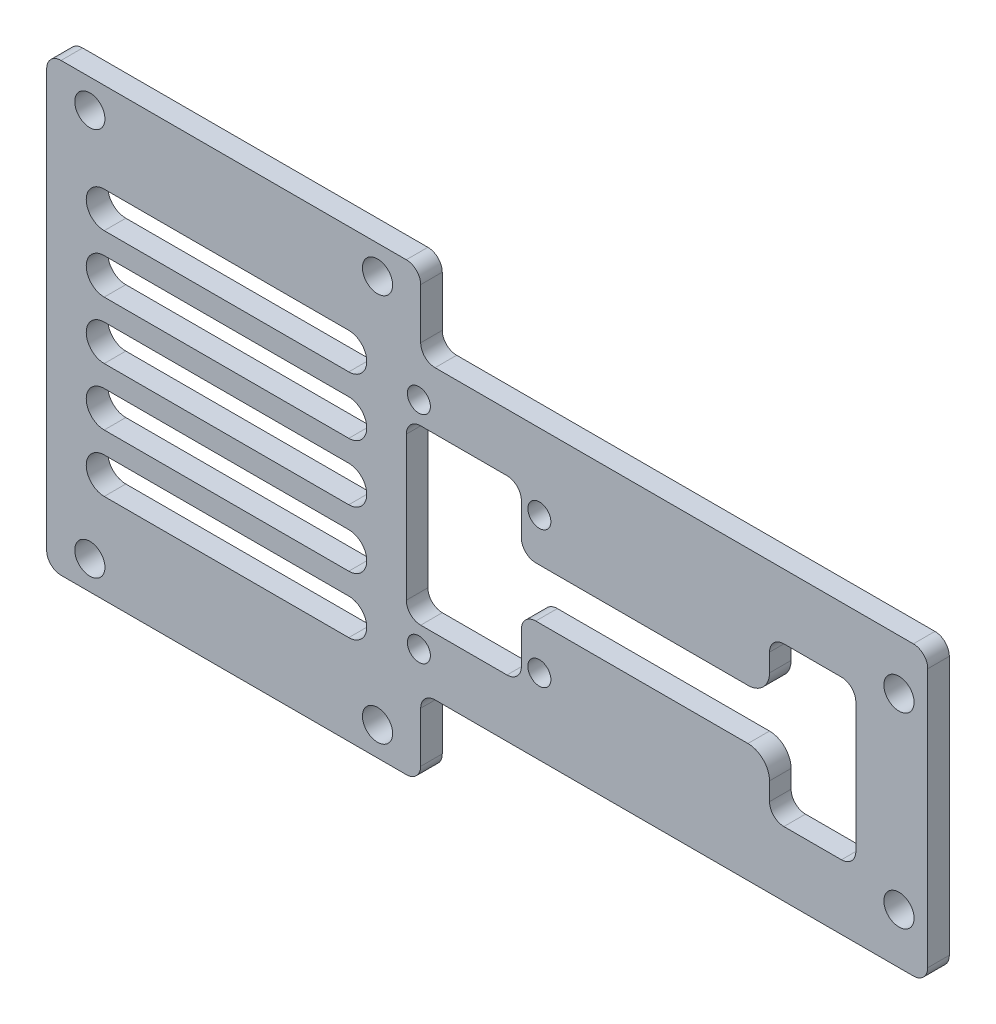
from build123d import *

# Parameters (mm, degrees)
SKETCH_1_R          = 2.1
SKETCH_1_R_2        = 1.599999998
SKETCH_1_R_3        = 2.099999998
SKETCH_1_R_4        = 1.6
EXTRUDE_1_DEPTH     = 3
FILLET_1_R          = 2
CUT_EXTRUDE_1_DEPTH = 115.739923305
SKETCH_3_W          = 8.5
SKETCH_3_H          = 7
CUT_EXTRUDE_2_DEPTH = 115.739923305
FILLET_2_R          = 3


with BuildPart() as part:
    # 草图1 → 凸台-拉伸1 (new body)
    with BuildSketch(Plane.XY):
        Polygon((-26, 0), (-26, -62), (26, -62), (26, -51), (96.5, -51), (96.5, -11), (26, -11), (26, 0), align=None)
        with Locations((-20, -4)):
            Circle(SKETCH_1_R, mode=Mode.SUBTRACT)
        with Locations((20, -4)):
            Circle(SKETCH_1_R, mode=Mode.SUBTRACT)
        with Locations((-20, -58)):
            Circle(SKETCH_1_R, mode=Mode.SUBTRACT)
        with Locations((20, -58)):
            Circle(SKETCH_1_R, mode=Mode.SUBTRACT)
        with Locations((42.500000002, -21.5)):
            Circle(SKETCH_1_R_2, mode=Mode.SUBTRACT)
        with Locations((42.500000002, -40.5)):
            Circle(SKETCH_1_R_2, mode=Mode.SUBTRACT)
        with Locations((92.500000002, -18)):
            Circle(SKETCH_1_R_3, mode=Mode.SUBTRACT)
        with Locations((92.500000002, -44)):
            Circle(SKETCH_1_R_3, mode=Mode.SUBTRACT)
        with Locations((25.75, -46)):
            Circle(SKETCH_1_R_4, mode=Mode.SUBTRACT)
        with Locations((25.75, -16)):
            Circle(SKETCH_1_R_4, mode=Mode.SUBTRACT)
        Polygon((68, -34.5), (68, -27.5), (40, -27.5), (40, -19), (24, -19), (24, -43), (40, -43), (40, -34.5), align=None, mode=Mode.SUBTRACT)
    extrude(amount=EXTRUDE_1_DEPTH)

    # 圆角1
    fillet_1_edges = [part.edges().sort_by_distance(p)[0] for p in [
        (26, 0, 1.5),
        (26, -11, 1.5),
        (96.5, -11, 1.5),
        (96.5, -51, 1.5),
        (26, -51, 1.5),
        (26, -62, 1.5),
        (-26, -62, 1.5),
        (-26, 0, 1.5),
        (40, -43, 1.5),
        (40, -34.5, 1.5),
        (68, -34.5, 1.5),
        (68, -27.5, 1.5),
        (40, -27.5, 1.5),
        (40, -19, 1.5),
        (24, -19, 1.5),
        (24, -43, 1.5),
    ]]
    fillet(fillet_1_edges, radius=FILLET_1_R)

    # 草图2 → 切除-拉伸1 (cut, through all)
    with BuildSketch(Plane.XY.offset(3)):
        with BuildLine():
            Line((-18, -28.5), (16, -28.5))
            ThreePointArc((16, -28.5), (18.5, -31), (16, -33.5))
            Line((16, -33.5), (-18, -33.5))
            ThreePointArc((-18, -33.5), (-20.5, -31), (-18, -28.5))
        make_face()
        with BuildLine():
            Line((-18, -20.5), (16, -20.5))
            ThreePointArc((16, -20.5), (18.5, -23), (16, -25.5))
            Line((16, -25.5), (-18, -25.5))
            ThreePointArc((-18, -25.5), (-20.5, -23), (-18, -20.5))
        make_face()
        with BuildLine():
            Line((-18, -12.5), (16, -12.5))
            ThreePointArc((16, -12.5), (18.5, -15), (16, -17.5))
            Line((16, -17.5), (-18, -17.5))
            ThreePointArc((-18, -17.5), (-20.5, -15), (-18, -12.5))
        make_face()
        with BuildLine():
            Line((-18, -36.5), (16, -36.5))
            ThreePointArc((16, -36.5), (18.5, -39), (16, -41.5))
            Line((16, -41.5), (-18, -41.5))
            ThreePointArc((-18, -41.5), (-20.5, -39), (-18, -36.5))
        make_face()
        with BuildLine():
            Line((-18, -44.5), (16, -44.5))
            ThreePointArc((16, -44.5), (18.5, -47), (16, -49.5))
            Line((16, -49.5), (-18, -49.5))
            ThreePointArc((-18, -49.5), (-20.5, -47), (-18, -44.5))
        make_face()
        with BuildLine():
            Line((74.5, -22), (74.5, -40))
            ThreePointArc((74.5, -40), (75.085786438, -41.414213562), (76.5, -42))
            Line((76.5, -42), (84.5, -42))
            ThreePointArc((84.5, -42), (85.914213562, -41.414213562), (86.5, -40))
            Line((86.5, -40), (86.5, -22))
            ThreePointArc((86.5, -22), (85.914213562, -20.585786438), (84.5, -20))
            Line((84.5, -20), (76.5, -20))
            ThreePointArc((76.5, -20), (75.085786438, -20.585786438), (74.5, -22))
        make_face()
    extrude(amount=-CUT_EXTRUDE_1_DEPTH, mode=Mode.SUBTRACT)

    # 草图3 → 切除-拉伸2 (cut, through all)
    with BuildSketch(Plane.XY.offset(3)):
        with Locations((70.25, -31)):
            Rectangle(SKETCH_3_W, SKETCH_3_H)
    extrude(amount=-CUT_EXTRUDE_2_DEPTH, mode=Mode.SUBTRACT)

    # 圆角2
    fillet_2_edges = [part.edges().sort_by_distance(p)[0] for p in [
        (74.5, -27.5, 1.5),
        (74.5, -34.5, 1.5),
    ]]
    fillet(fillet_2_edges, radius=FILLET_2_R)


solid = part.part
